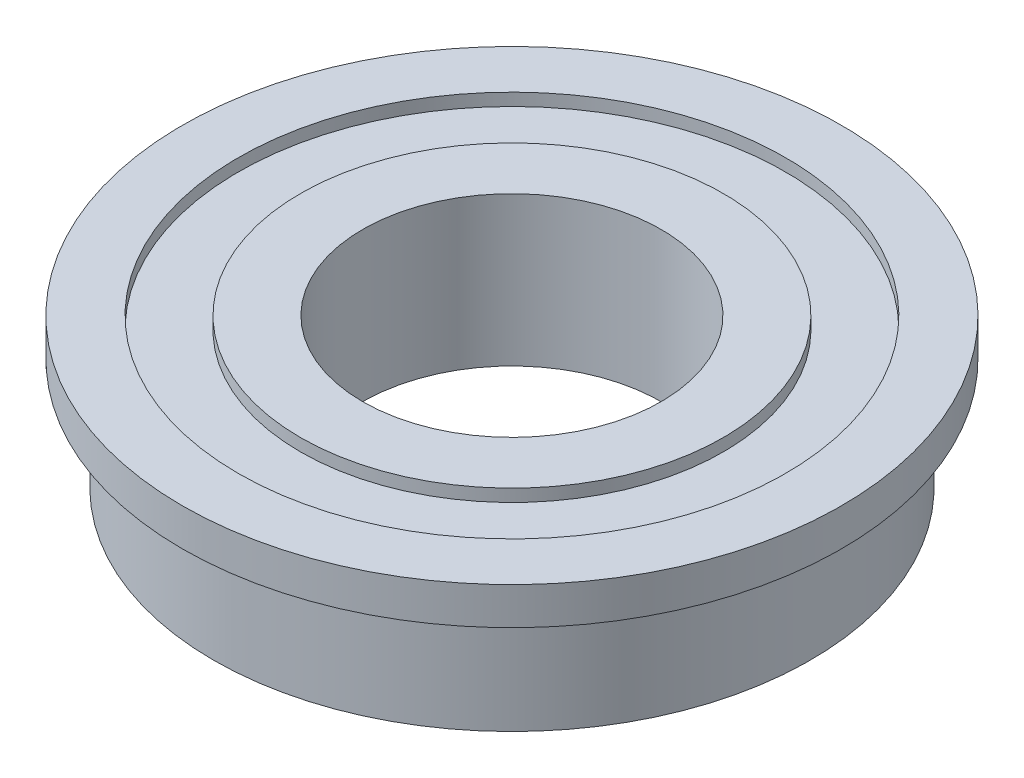
from build123d import *

# Parameters (mm, degrees)
SKETCH1_R           = 12
SKETCH1_R_2         = 6
BOSS_EXTRUDE1_DEPTH = 6
SKETCH1_3_R         = 13.25
SKETCH1_3_R_2       = 12
BOSS_EXTRUDE2_DEPTH = 1.5
SKETCH2_R           = 11
SKETCH2_R_2         = 8.5
CUT_EXTRUDE1_DEPTH  = 0.5
CUT_EXTRUDE2_START  = -0.5
SKETCH3_R           = 11
SKETCH3_R_2         = 8.5
CUT_EXTRUDE2_DEPTH  = 0.5


with BuildPart() as part:
    # Sketch1 → Boss-Extrude1 (new body)
    with BuildSketch(Plane(origin=(0, 0, 0), x_dir=(1, 0, 0), z_dir=(0, 1, 0))):
        Circle(SKETCH1_R)
        Circle(SKETCH1_R_2, mode=Mode.SUBTRACT)
    extrude(amount=-BOSS_EXTRUDE1_DEPTH)

    # Sketch1<3> → Boss-Extrude2 (add)
    with BuildSketch(Plane(origin=(0, 0, 0), x_dir=(1, 0, 0), z_dir=(0, 1, 0))):
        Circle(SKETCH1_3_R)
        Circle(SKETCH1_3_R_2, mode=Mode.SUBTRACT)
    extrude(amount=-BOSS_EXTRUDE2_DEPTH)

    # Sketch2 → Cut-Extrude1 (cut)
    with BuildSketch(Plane(origin=(0, 0, 0), x_dir=(1, 0, 0), z_dir=(0, 1, 0))):
        Circle(SKETCH2_R)
        Circle(SKETCH2_R_2, mode=Mode.SUBTRACT)
    extrude(amount=-CUT_EXTRUDE1_DEPTH, mode=Mode.SUBTRACT)

    # Sketch3 → Cut-Extrude2 (cut)
    with BuildSketch(Plane.XZ.offset(6).offset(CUT_EXTRUDE2_START)):
        Circle(SKETCH3_R)
        Circle(SKETCH3_R_2, mode=Mode.SUBTRACT)
    extrude(amount=CUT_EXTRUDE2_DEPTH, mode=Mode.SUBTRACT)


solid = part.part
